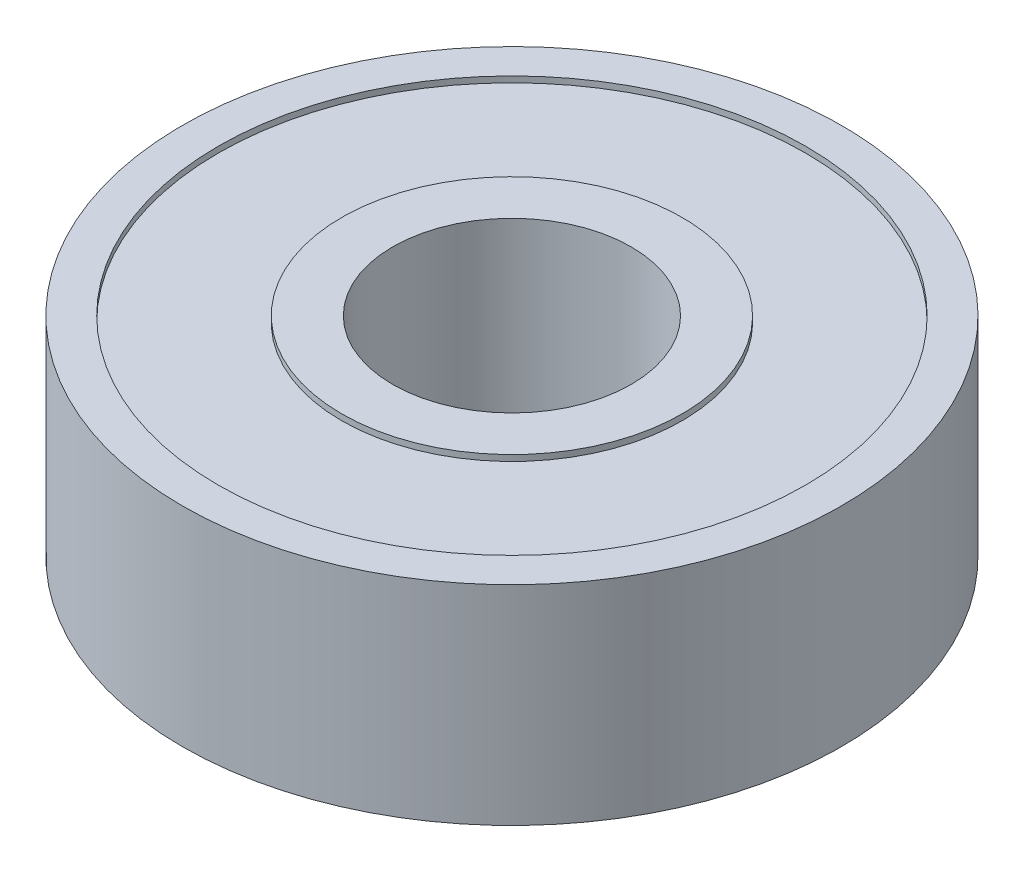
from build123d import *

# Parameters (mm, degrees)
SKETCH3_R           = 11
SKETCH3_R_2         = 3.98
BOSS_EXTRUDE1_DEPTH = 3.48
SKETCH4_R           = 9.8
SKETCH4_R_2         = 5.68
CUT_EXTRUDE1_DEPTH  = 0.2


with BuildPart() as part:
    # Sketch3 → Boss-Extrude1 (new, symmetric)
    with BuildSketch(Plane(origin=(0, 0, 0), x_dir=(1, 0, 0), z_dir=(0, 1, 0))):
        with Locations(Location((0, 0, 0), (0, 0, 270))):
            Circle(SKETCH3_R)
        with Locations(Location((0, 0, 0), (0, 0, 270))):
            Circle(SKETCH3_R_2, mode=Mode.SUBTRACT)
    extrude(amount=BOSS_EXTRUDE1_DEPTH, both=True)

    # Sketch4 → Cut-Extrude1 (cut)
    with BuildSketch(Plane(origin=(0, 3.48, 0), x_dir=(1, 0, 0), z_dir=(0, 1, 0))):
        with Locations(Location((0, 0, 0), (0, 0, 270))):
            Circle(SKETCH4_R)
        with Locations(Location((0, 0, 0), (0, 0, 270))):
            Circle(SKETCH4_R_2, mode=Mode.SUBTRACT)
    cut_extrude1 = extrude(amount=-CUT_EXTRUDE1_DEPTH, mode=Mode.SUBTRACT)

    # Mirror1: Cut-Extrude1 across plane
    add(cut_extrude1.mirror(Plane.ZX), mode=Mode.SUBTRACT)


solid = part.part
